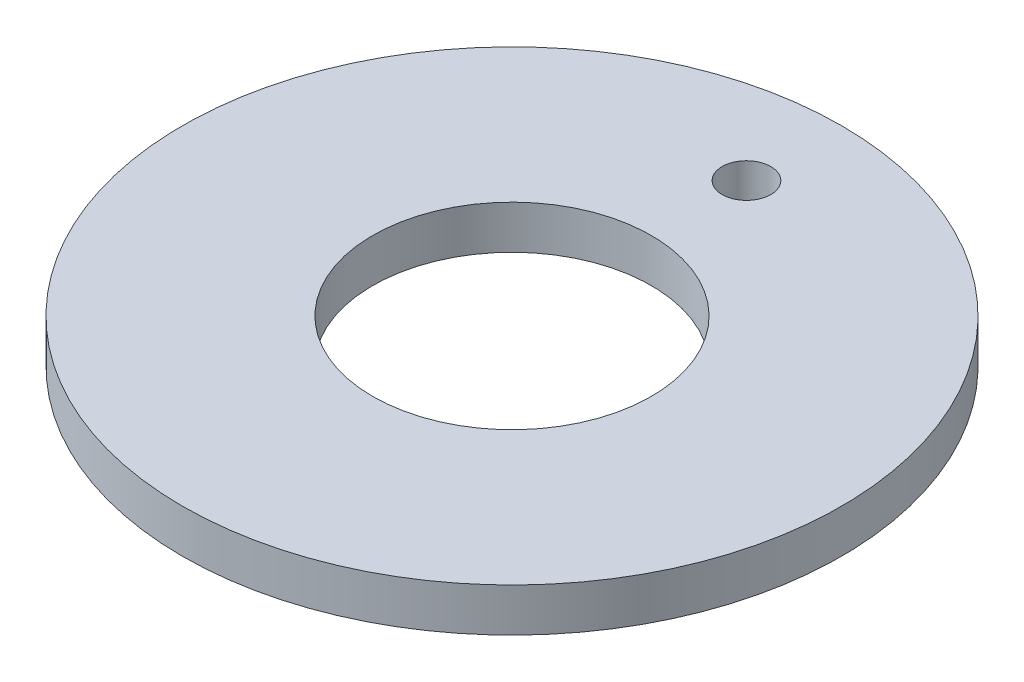
from build123d import *

# Parameters (mm, degrees)
SKETCH1_R           = 37.95
SKETCH1_R_2         = 16.05
SKETCH1_R_3         = 2.8
BOSS_EXTRUDE1_DEPTH = 5


with BuildPart() as part:
    # Sketch1 → Boss-Extrude1 (new body)
    with BuildSketch(Plane(origin=(0, 0, 0), x_dir=(1, 0, 0), z_dir=(0, 1, 0))):
        with Locations(Location((0, 0, 0), (0, 0, 270))):
            Circle(SKETCH1_R)
        with Locations(Location((0, 0, 0), (0, 0, 270))):
            Circle(SKETCH1_R_2, mode=Mode.SUBTRACT)
        with Locations(Location((0, 27, 0), (0, 0, 270))):
            Circle(SKETCH1_R_3, mode=Mode.SUBTRACT)
    extrude(amount=BOSS_EXTRUDE1_DEPTH)


solid = part.part
